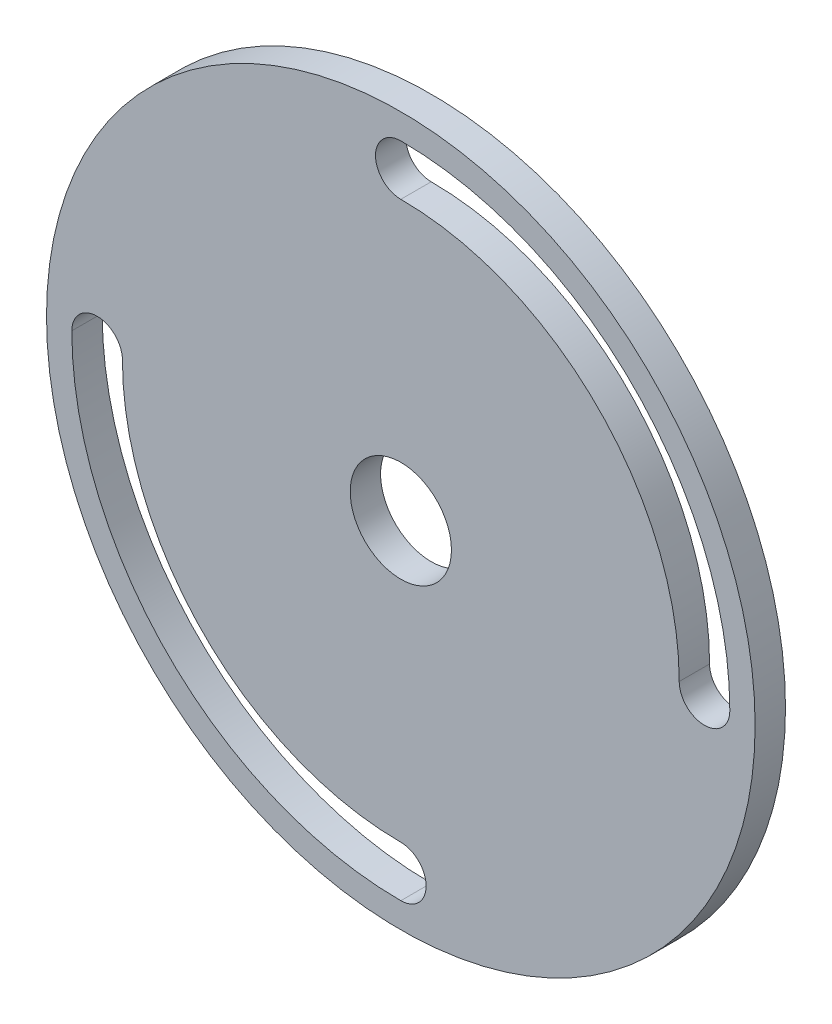
from build123d import *

# Parameters (mm, degrees)
SKETCH_1_R      = 35
SKETCH_1_R_2    = 5
EXTRUDE_1_DEPTH = 3


with BuildPart() as part:
    # 스케치1 → 보스-돌출1 (new body)
    with BuildSketch(Plane.XY):
        Circle(SKETCH_1_R)
        with BuildLine():
            ThreePointArc((32.5, 0), (30, -2.5), (27.5, 0))
            ThreePointArc((27.5, 0), (19.445436483, 19.445436483), (0, 27.5))
            ThreePointArc((0, 27.5), (-2.5, 30), (0, 32.5))
            ThreePointArc((0, 32.5), (22.980970389, 22.980970389), (32.5, 0))
        make_face(mode=Mode.SUBTRACT)
        with BuildLine():
            ThreePointArc((0, -27.5), (2.5, -30), (0, -32.5))
            ThreePointArc((0, -32.5), (-22.980970405, -22.980970372), (-32.5, 4.6e-08))
            ThreePointArc((-32.5, 4.6e-08), (-29.999999977, 2.5), (-27.5, 0))
            ThreePointArc((-27.5, 0), (-19.445436483, -19.445436483), (0, -27.5))
        make_face(mode=Mode.SUBTRACT)
        Circle(SKETCH_1_R_2, mode=Mode.SUBTRACT)
    extrude(amount=EXTRUDE_1_DEPTH)


solid = part.part
